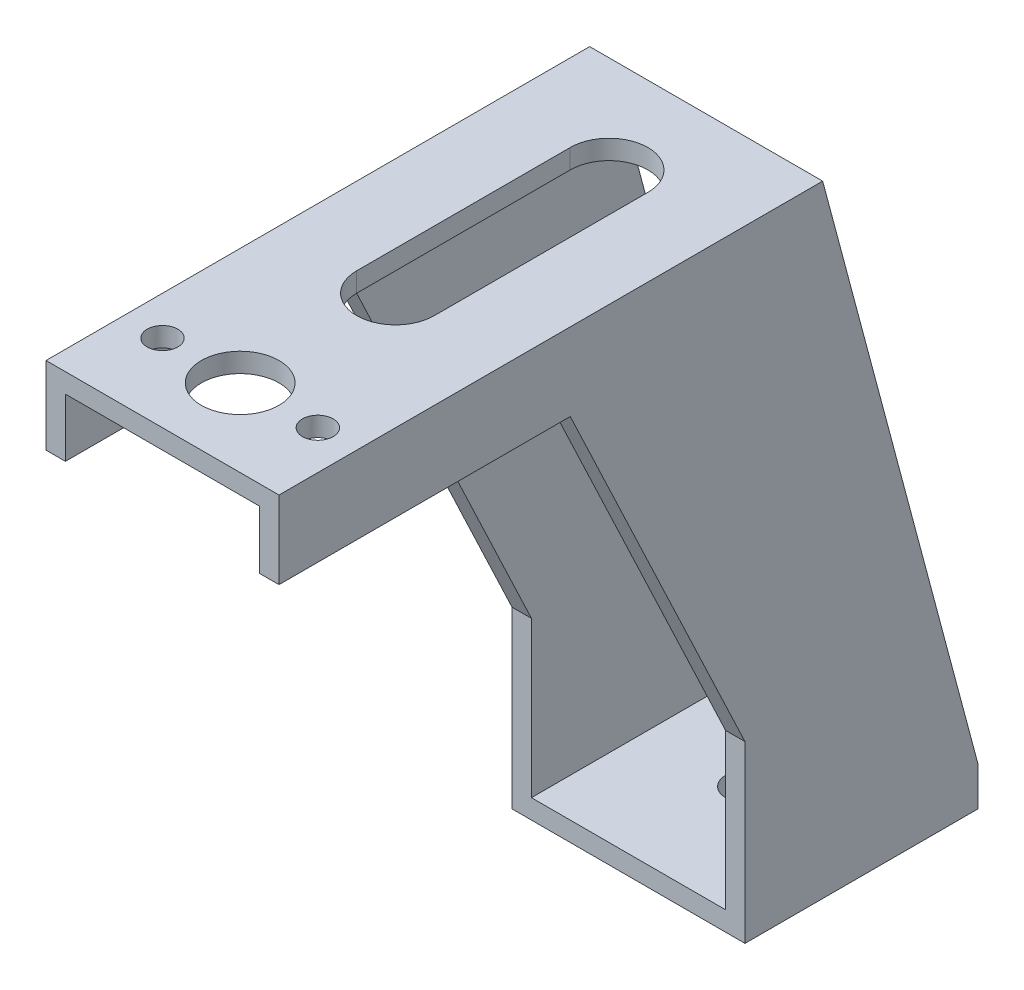
from build123d import *

# Parameters (mm, degrees)
SKETCH3_W           = 38.1
SKETCH3_H           = 101.6
SKETCH3_W_2         = 31.75
SKETCH3_H_2         = 95.25
BOSS_EXTRUDE1_DEPTH = 114.3
CUT_EXTRUDE1_DEPTH  = 158.602855304
CUT_EXTRUDE2_REACH  = 159.603
SKETCH6_R           = 2.4003
SKETCH6_R_2         = 3.175
CUT_EXTRUDE3_REACH  = 159.603
SKETCH7_R           = 2.5146
SKETCH7_R_2         = 6.35


with BuildPart() as part:
    # Sketch3 → Boss-Extrude1 (new body)
    with BuildSketch(Plane.XY):
        with Locations((19.05, 50.8)):
            Rectangle(SKETCH3_W, SKETCH3_H)
        with Locations((19.05, 50.8)):
            Rectangle(SKETCH3_W_2, SKETCH3_H_2, mode=Mode.SUBTRACT)
    extrude(amount=BOSS_EXTRUDE1_DEPTH)

    # Sketch5 → Cut-Extrude1 (cut, through all)
    with BuildSketch(Plane.ZY):
        Polygon((0, 101.6), (0, 6.35), (25.4, 101.6), align=None)
        Polygon((66.675, 88.9), (38.1, 28.575), (38.1, 0), (114.3, 0), (114.3, 88.9), align=None)
    extrude(amount=-CUT_EXTRUDE1_DEPTH, mode=Mode.SUBTRACT)

    # Sketch6 → Cut-Extrude2 (cut, up to next)
    with BuildSketch(Plane.XZ, mode=Mode.PRIVATE) as cut_extrude2_sk1:
        with Locations(Location((31.75, 6.35, 0), (0, 0, 270))):
            Circle(SKETCH6_R)
    cut_extrude2_tool1 = extrude(cut_extrude2_sk1.sketch, amount=-CUT_EXTRUDE2_REACH, mode=Mode.PRIVATE) & part.part
    # Sketch6 → Cut-Extrude2 (cut, up to next)
    with BuildSketch(Plane.XZ, mode=Mode.PRIVATE) as cut_extrude2_sk2:
        with Locations(Location((6.35, 6.35, 0), (0, 0, 270))):
            Circle(SKETCH6_R)
    cut_extrude2_tool2 = extrude(cut_extrude2_sk2.sketch, amount=-CUT_EXTRUDE2_REACH, mode=Mode.PRIVATE) & part.part
    # Sketch6 → Cut-Extrude2 (cut, up to next)
    with BuildSketch(Plane.XZ, mode=Mode.PRIVATE) as cut_extrude2_sk3:
        with Locations(Location((19.05, 19.05, 0), (0, 0, 270))):
            Circle(SKETCH6_R_2)
    cut_extrude2_tool3 = extrude(cut_extrude2_sk3.sketch, amount=-CUT_EXTRUDE2_REACH, mode=Mode.PRIVATE) & part.part
    add(cut_extrude2_tool1.solids().sort_by_distance((31.75, 0, 6.35))[0], mode=Mode.SUBTRACT)
    add(cut_extrude2_tool2.solids().sort_by_distance((6.35, 0, 6.35))[0], mode=Mode.SUBTRACT)
    add(cut_extrude2_tool3.solids().sort_by_distance((19.05, 0, 19.05))[0], mode=Mode.SUBTRACT)

    # Sketch7 → Cut-Extrude3 (cut, up to next)
    with BuildSketch(Plane(origin=(0, 101.6, 0), x_dir=(1, 0, 0), z_dir=(0, 1, 0)), mode=Mode.PRIVATE) as cut_extrude3_sk1:
        with Locations(Location((6.35, -101.6, 0), (0, 0, 270))):
            Circle(SKETCH7_R)
    cut_extrude3_tool1 = extrude(cut_extrude3_sk1.sketch, amount=-CUT_EXTRUDE3_REACH, mode=Mode.PRIVATE) & part.part
    # Sketch7 → Cut-Extrude3 (cut, up to next)
    with BuildSketch(Plane(origin=(0, 101.6, 0), x_dir=(1, 0, 0), z_dir=(0, 1, 0)), mode=Mode.PRIVATE) as cut_extrude3_sk2:
        with Locations(Location((31.75, -101.6, 0), (0, 0, 270))):
            Circle(SKETCH7_R)
    cut_extrude3_tool2 = extrude(cut_extrude3_sk2.sketch, amount=-CUT_EXTRUDE3_REACH, mode=Mode.PRIVATE) & part.part
    # Sketch7 → Cut-Extrude3 (cut, up to next)
    with BuildSketch(Plane(origin=(0, 101.6, 0), x_dir=(1, 0, 0), z_dir=(0, 1, 0)), mode=Mode.PRIVATE) as cut_extrude3_sk3:
        with Locations(Location((19.05, -101.6, 0), (0, 0, 270))):
            Circle(SKETCH7_R_2)
    cut_extrude3_tool3 = extrude(cut_extrude3_sk3.sketch, amount=-CUT_EXTRUDE3_REACH, mode=Mode.PRIVATE) & part.part
    # Sketch7 → Cut-Extrude3 (cut, up to next)
    with BuildSketch(Plane(origin=(0, 101.6, 0), x_dir=(1, 0, 0), z_dir=(0, 1, 0)), mode=Mode.PRIVATE) as cut_extrude3_sk4:
        with BuildLine():
            Line((25.4, -41.275), (25.4, -76.2))
            ThreePointArc((25.4, -76.2), (19.05, -82.55), (12.7, -76.2))
            Line((12.7, -76.2), (12.7, -41.275))
            ThreePointArc((12.7, -41.275), (19.05, -34.925), (25.4, -41.275))
        make_face()
    cut_extrude3_tool4 = extrude(cut_extrude3_sk4.sketch, amount=-CUT_EXTRUDE3_REACH, mode=Mode.PRIVATE) & part.part
    add(cut_extrude3_tool1.solids().sort_by_distance((6.35, 101.6, 101.6))[0], mode=Mode.SUBTRACT)
    add(cut_extrude3_tool2.solids().sort_by_distance((31.75, 101.6, 101.6))[0], mode=Mode.SUBTRACT)
    add(cut_extrude3_tool3.solids().sort_by_distance((19.05, 101.6, 101.6))[0], mode=Mode.SUBTRACT)
    add(cut_extrude3_tool4.solids().sort_by_distance((19.05, 101.6, 58.7375))[0], mode=Mode.SUBTRACT)


solid = part.part
